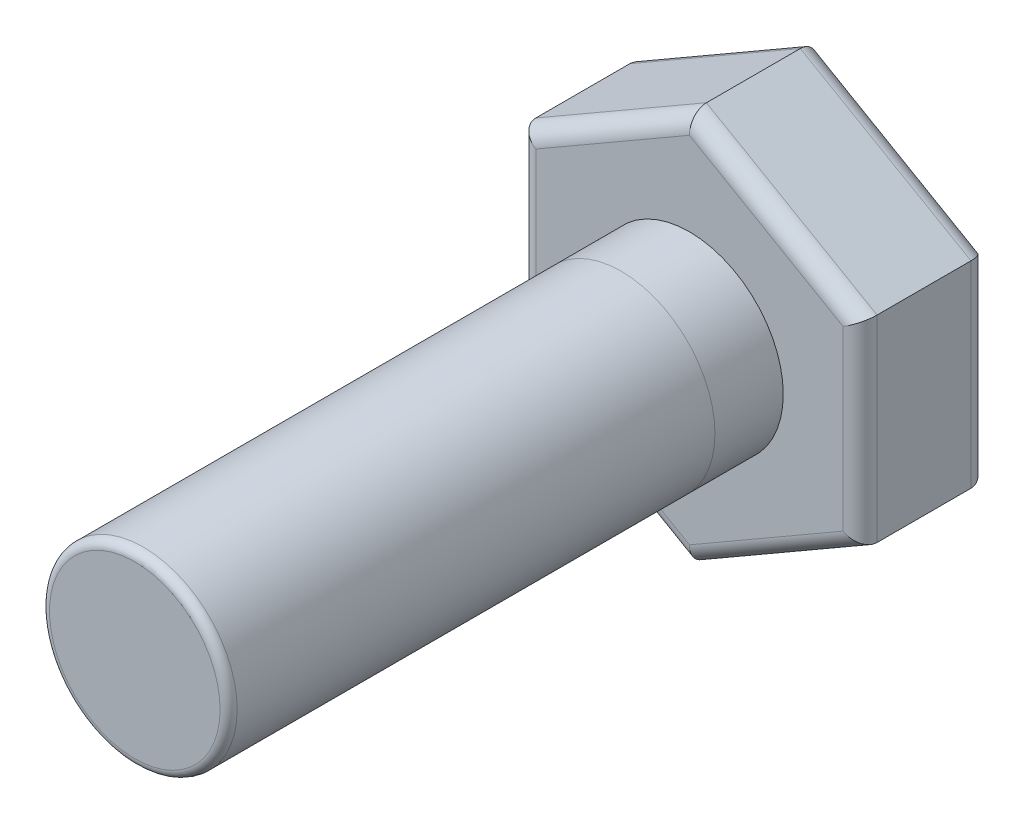
from build123d import *

# Parameters (mm, degrees)
EXTRUDE_411_DEPTH = 15
SKETCH_2_R        = 11
EXTRUDE_1_DEPTH   = 8
FILLET_3_R        = 2
SKETCH_3_R        = 10.995
EXTRUDE_1_2_DEPTH = 57
FILLET_4_R        = 1


with BuildPart() as part:
    # 草图1 → Extrude 411 (new body)
    with BuildSketch(Plane.XY):
        Polygon((20, 11.547005384), (0, 23.094010768), (-20, 11.547005384), (-20, -11.547005384), (0, -23.094010768), (20, -11.547005384), align=None)
    extrude(amount=EXTRUDE_411_DEPTH)

    # 草图2 → Extrude 1 (add)
    with BuildSketch(Plane.XY.offset(15)):
        Circle(SKETCH_2_R)
    extrude(amount=EXTRUDE_1_DEPTH)

    # 圆角3
    fillet_3_edges = [part.edges().sort_by_distance(p)[0] for p in [
        (-10, 17.320508076, 15),
        (-20, 0, 15),
        (-10, -17.320508076, 15),
        (10, -17.320508076, 15),
        (20, 0, 15),
        (10, -17.320508076, 0),
        (-10, -17.320508076, 0),
        (-20, 0, 0),
        (10, 17.320508076, 15),
        (-10, 17.320508076, 0),
        (10, 17.320508076, 0),
        (20, 0, 0),
    ]]
    fillet(fillet_3_edges, radius=FILLET_3_R)

    # 草图3 → Extrude 1 2 (add)
    with BuildSketch(Plane.XY.offset(23)):
        Circle(SKETCH_3_R)
    extrude(amount=EXTRUDE_1_2_DEPTH)

    # 圆角4
    fillet_4_edges = [part.edges().sort_by_distance(p)[0] for p in [
        (-10.995, 0, 80),
    ]]
    fillet(fillet_4_edges, radius=FILLET_4_R)


solid = part.part
